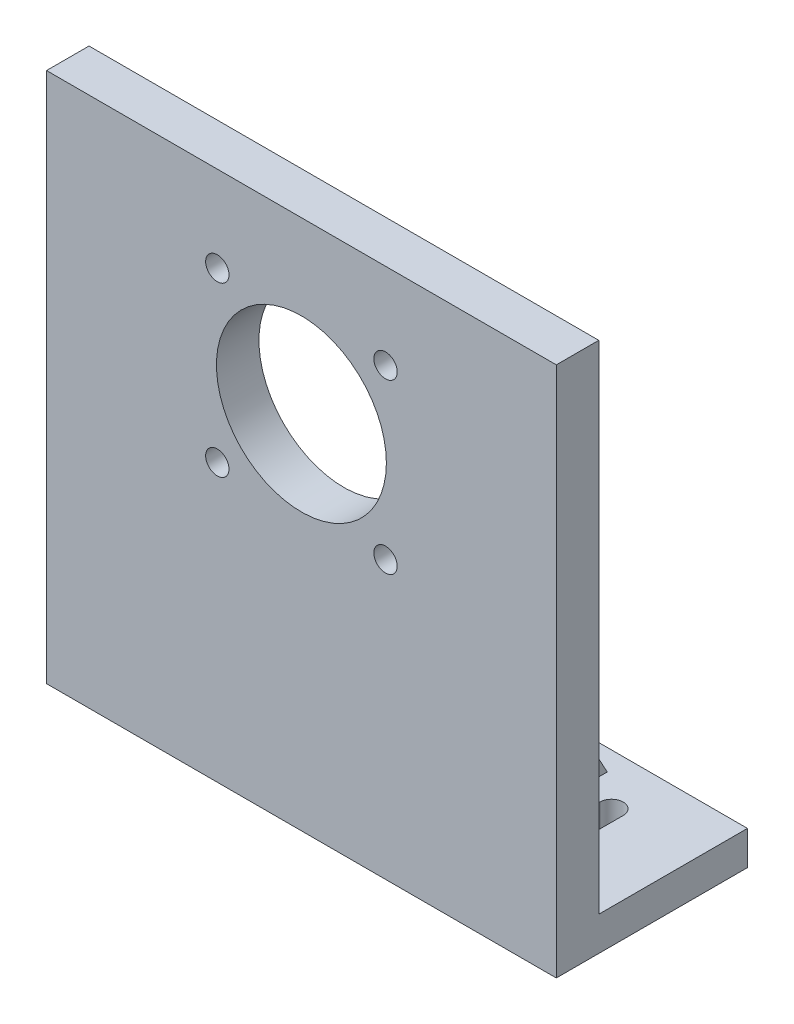
from build123d import *

# Parameters (mm, degrees)
SKETCH_1_W          = 120
SKETCH_1_H          = 125
SKETCH_1_R          = 20
SKETCH_1_R_2        = 2.75
EXTRUDE_1_DEPTH     = 10
SKETCH_2_W          = 120
SKETCH_2_H          = 35
EXTRUDE_3_DEPTH     = 8
EXTRUDE_4_DEPTH     = 32
CUT_EXTRUDE_1_DEPTH = 24


with BuildPart() as part:
    # 草图1 → 凸台-拉伸1 (new body)
    with BuildSketch(Plane.XY):
        with Locations((0, 62.5)):
            Rectangle(SKETCH_1_W, SKETCH_1_H)
        with Locations((0, 85)):
            Circle(SKETCH_1_R, mode=Mode.SUBTRACT)
        with Locations((19.798989873, 104.798989873)):
            Circle(SKETCH_1_R_2, mode=Mode.SUBTRACT)
        with Locations((-19.798989873, 104.798989873)):
            Circle(SKETCH_1_R_2, mode=Mode.SUBTRACT)
        with Locations((-19.798989873, 65.201010127)):
            Circle(SKETCH_1_R_2, mode=Mode.SUBTRACT)
        with Locations((19.798989873, 65.201010127)):
            Circle(SKETCH_1_R_2, mode=Mode.SUBTRACT)
    extrude(amount=-EXTRUDE_1_DEPTH)

    # 草图2 → 凸台-拉伸3 (add)
    with BuildSketch(Plane(origin=(0, 0, 0), x_dir=(1, 0, 0), z_dir=(0, 1, 0))):
        with Locations((0, 27.5)):
            Rectangle(SKETCH_2_W, SKETCH_2_H)
        with BuildLine():
            Line((-42.75, 27.5), (-42.75, 33))
            ThreePointArc((-42.75, 33), (-40, 35.75), (-37.25, 33))
            Line((-37.25, 33), (-37.25, 27.5))
            ThreePointArc((-37.25, 27.5), (-40, 24.75), (-42.75, 27.5))
        make_face(mode=Mode.SUBTRACT)
        with BuildLine():
            Line((37.25, 27.5), (37.25, 33))
            ThreePointArc((37.25, 33), (40, 35.75), (42.75, 33))
            Line((42.75, 33), (42.75, 27.5))
            ThreePointArc((42.75, 27.5), (40, 24.75), (37.25, 27.5))
        make_face(mode=Mode.SUBTRACT)
    extrude(amount=EXTRUDE_3_DEPTH)

    # 草图3 → 凸台-拉伸4 (add, symmetric)
    with BuildSketch(Plane(origin=(0, 0, 0), x_dir=(0, 0, -1), z_dir=(1, 0, 0))):
        Polygon((10, 8), (40, 8), (10, 63), align=None)
    extrude(amount=EXTRUDE_4_DEPTH, both=True)

    # 草图4 → 切除-拉伸1 (cut, symmetric)
    with BuildSketch(Plane(origin=(0, 0, 0), x_dir=(0, 0, -1), z_dir=(1, 0, 0))):
        Polygon((10, 8), (40, 8), (10, 63), align=None)
    extrude(amount=CUT_EXTRUDE_1_DEPTH, both=True, mode=Mode.SUBTRACT)


solid = part.part
